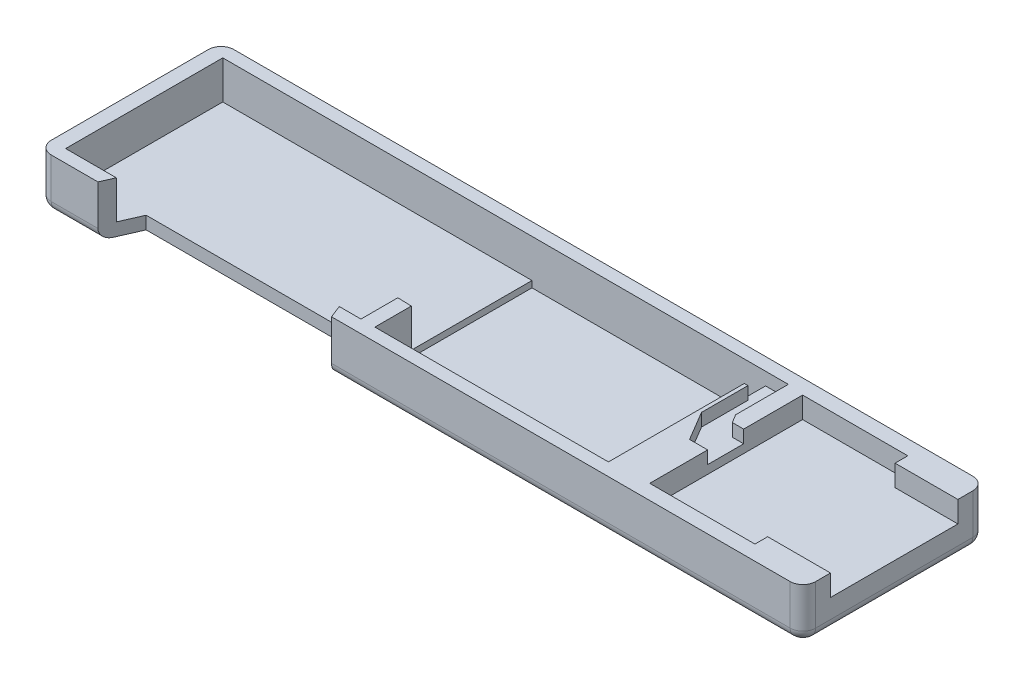
from build123d import *

# Parameters (mm, degrees)
SKETCH_3_W          = 180
SKETCH_3_H          = 43
EXTRUDE_1_DEPTH     = 12
CUT_EXTRUDE_1_DEPTH = 52
CUT_EXTRUDE_2_DEPTH = 5
CUT_EXTRUDE_3_DEPTH = 5
SKETCH_8_W          = 55
SKETCH_8_H          = 37
CUT_EXTRUDE_4_DEPTH = 10.5
CUT_EXTRUDE_5_DEPTH = 3
SKETCH_10_W         = 62.128790526
SKETCH_10_H         = 8.683746703
CUT_EXTRUDE_6_DEPTH = 8
CUT_EXTRUDE_8_DEPTH = 9
FILLET_3_R          = 3
FILLET_4_R          = 2.5


with BuildPart() as part:
    # 草图3 → 凸台-拉伸1 (new body)
    with BuildSketch(Plane(origin=(0, 0, 0), x_dir=(1, 0, 0), z_dir=(0, 1, 0))):
        with Locations((50.068597249, 7.753123643)):
            Rectangle(SKETCH_3_W, SKETCH_3_H)
    extrude(amount=EXTRUDE_1_DEPTH)

    # 草图4 → 切除-拉伸1 (cut)
    with BuildSketch(Plane(origin=(0, 0, 0), x_dir=(1, 0, 0), z_dir=(0, 1, 0))):
        Polygon((-22.469613434, -5.858946979), (26.002261286, -5.858946979), (29.068597249, -13.746876357), (-25.931402751, -13.746876357), align=None)
    extrude(amount=CUT_EXTRUDE_1_DEPTH, mode=Mode.SUBTRACT)

    # 草图5 → 切除-拉伸2 (cut)
    with BuildSketch(Plane(origin=(0, 12, 0), x_dir=(1, 0, 0), z_dir=(0, 1, 0))):
        Polygon((140.068597249, 7.753123643), (140.068597249, 22.753123643), (125.276479966, 22.753123643), (125.276479966, -7.246876357), (140.068597249, -7.246876357), align=None)
    extrude(amount=-CUT_EXTRUDE_2_DEPTH, mode=Mode.SUBTRACT)

    # 草图7 → 切除-拉伸3 (cut)
    with BuildSketch(Plane(origin=(0, 12, 0), x_dir=(1, 0, 0), z_dir=(0, 1, 0))):
        Polygon((125.276479966, 7.753123643), (125.276479966, 25.753123643), (100.500825538, 25.753123643), (100.500825538, -10.246876357), (125.276479966, -10.246876357), align=None)
    extrude(amount=-CUT_EXTRUDE_3_DEPTH, mode=Mode.SUBTRACT)

    # 草图8 → 切除-拉伸4 (cut)
    with BuildSketch(Plane(origin=(0, 12, 0), x_dir=(1, 0, 0), z_dir=(0, 1, 0))):
        with Locations((63.776287419, 7.753123643)):
            Rectangle(SKETCH_8_W, SKETCH_8_H)
    extrude(amount=-CUT_EXTRUDE_4_DEPTH, mode=Mode.SUBTRACT)

    # 草图9 → 切除-拉伸5 (cut)
    with BuildSketch(Plane(origin=(0, 12, 0), x_dir=(1, 0, 0), z_dir=(0, 1, 0))):
        Polygon((91.276287419, 26.253123643), (96.635770173, 26.253123643), (96.635770173, 22.130591531), (96.635770173, 13.862098754), (97.813575381, 11.877191358), (100.500825538, 11.877191358), (100.500825538, 3.393971617), (96.236747254, 3.393971617), (92.132656028, 10.310430274), (92.132656028, 21.255120764), (91.276287419, 21.255120764), align=None)
    extrude(amount=-CUT_EXTRUDE_5_DEPTH, mode=Mode.SUBTRACT)

    # 草图10 → 切除-拉伸6 (cut)
    with BuildSketch(Plane(origin=(0, 12, 0), x_dir=(1, 0, 0), z_dir=(0, 1, 0))):
        with Locations((1.934159822, -6.405003006)):
            Rectangle(SKETCH_10_W, SKETCH_10_H)
    extrude(amount=-CUT_EXTRUDE_6_DEPTH, mode=Mode.SUBTRACT)

    # 草图11 → 切除-拉伸8 (cut)
    with BuildSketch(Plane(origin=(0, 12, 0), x_dir=(1, 0, 0), z_dir=(0, 1, 0))):
        Polygon((32.998555085, -10.746876357), (-36.5396752, -10.746876357), (-36.5396752, 26.253123643), (36.276287419, 26.253123643), (36.276287419, -2.167243749), (32.998555085, -2.063129654), align=None)
    extrude(amount=-CUT_EXTRUDE_8_DEPTH, mode=Mode.SUBTRACT)

    # 圆角3
    fillet_3_edges = [part.edges().sort_by_distance(p)[0] for p in [
        (-39.931402751, 6, -29.253123643),
        (140.068597249, 6, -29.253123643),
        (140.068597249, 6, 13.746876357),
        (-39.931402751, 6, 13.746876357),
    ]]
    fillet(fillet_3_edges, radius=FILLET_3_R)

    # 圆角4
    fillet_4_edges = [part.edges().sort_by_distance(p)[0] for p in [
        (83.068597249, 0, 13.746876357),
        (50.068597249, 0, -29.253123643),
        (-31.431402751, 0, 13.746876357),
        (-39.931402751, 0, -7.753123643),
        (140.068597249, 0, -7.753123643),
        (-39.052723094, 0, -28.374443987),
        (-39.052723094, 0, 12.8681967),
        (139.189917593, 0, 12.8681967),
        (139.189917593, 0, -28.374443987),
    ]]
    fillet(fillet_4_edges, radius=FILLET_4_R)


solid = part.part
